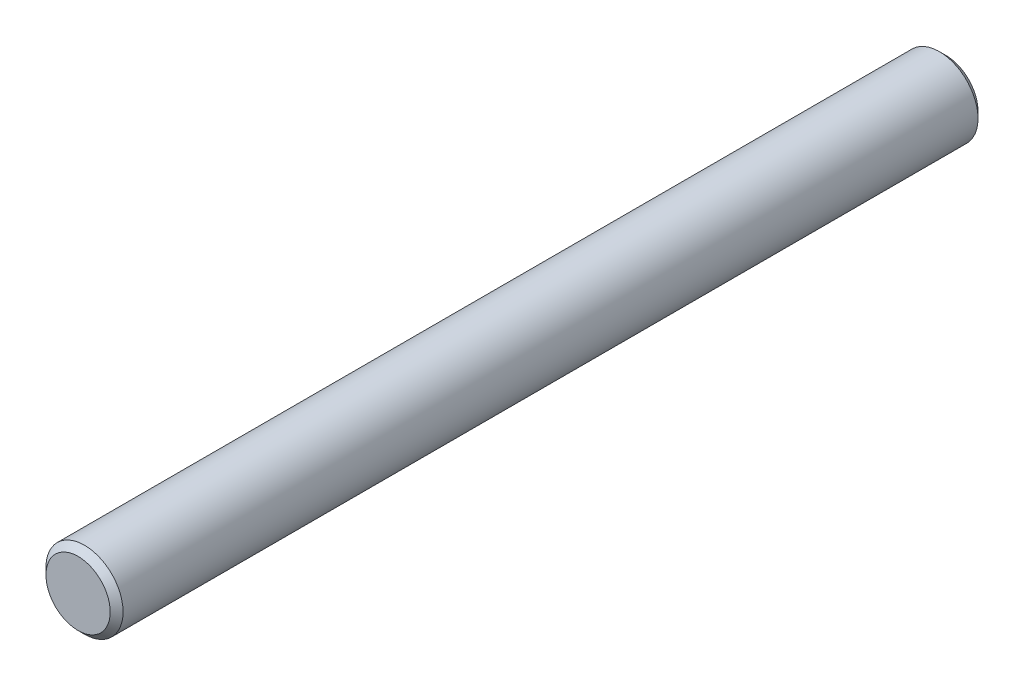
from build123d import *

# Parameters (mm, degrees)
SKETCH_3_R      = 6
EXTRUDE_1_DEPTH = 67.5
CHAMFER_1_SIZE  = 1


with BuildPart() as part:
    # Эскиз3 → Бобышка-Вытянуть1 (new, symmetric)
    with BuildSketch(Plane.XY):
        Circle(SKETCH_3_R)
    extrude(amount=EXTRUDE_1_DEPTH, both=True)

    # Фаска1
    chamfer_1_edges = [part.edges().sort_by_distance(p)[0] for p in [
        (-6, 0, -67.5),
        (-6, 0, 67.5),
    ]]
    chamfer(chamfer_1_edges, length=CHAMFER_1_SIZE)


solid = part.part
